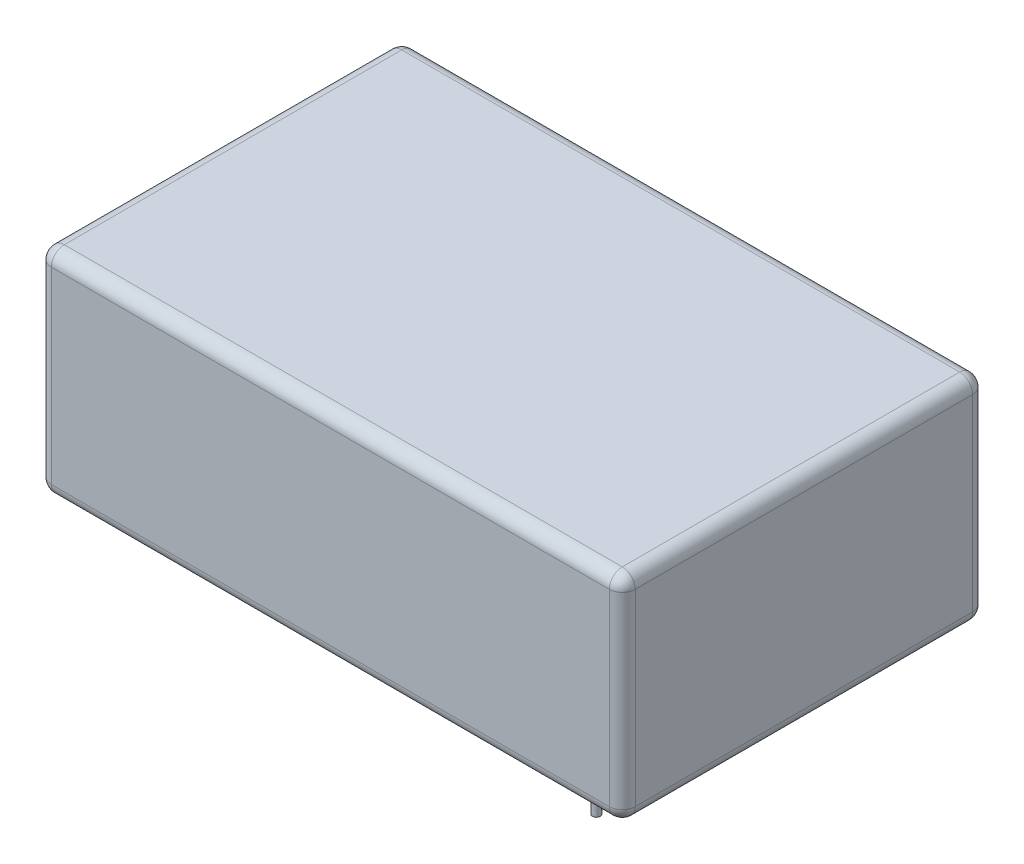
from build123d import *

# Parameters (mm, degrees)
SKETCH1_W           = 45
SKETCH1_H           = 16.5
BOSS_EXTRUDE1_DEPTH = 28
SKETCH2_R           = 0.3
BOSS_EXTRUDE2_DEPTH = 4
FILLET1_R           = 1


with BuildPart() as part:
    # Sketch1 → Boss-Extrude1 (new body)
    with BuildSketch(Plane.XY):
        with Locations((22.5, 8.25)):
            Rectangle(SKETCH1_W, SKETCH1_H)
    extrude(amount=BOSS_EXTRUDE1_DEPTH)

    # Sketch2 → Boss-Extrude2 (add)
    with BuildSketch(Plane(origin=(0, 0, 0), x_dir=(-1, 0, 0), z_dir=(0, -1, 0))):
        with Locations(Location((-6, -19, 0), (0, 0, 270))):
            Circle(SKETCH2_R)
        with Locations(Location((-6, -9, 0), (0, 0, 270))):
            Circle(SKETCH2_R)
        with Locations(Location((-39, -24, 0), (0, 0, 270))):
            Circle(SKETCH2_R)
        with Locations(Location((-39, -4, 0), (0, 0, 270))):
            Circle(SKETCH2_R)
    extrude(amount=BOSS_EXTRUDE2_DEPTH)

    # Fillet1
    fillet1_edges = [part.edges().sort_by_distance(p)[0] for p in [
        (45, 8.25, 28),
        (22.5, 16.5, 28),
        (6, 0, 18.7),
        (6, 0, 8.7),
        (39, 0, 23.7),
        (39, 0, 3.7),
        (0, 8.25, 28),
        (22.5, 16.5, 0),
        (45, 8.25, 0),
        (22.5, 0, 0),
        (0, 8.25, 0),
        (22.5, 0, 28),
        (0, 16.5, 14),
        (45, 16.5, 14),
        (45, 0, 14),
        (0, 0, 14),
    ]]
    fillet(fillet1_edges, radius=FILLET1_R)


solid = part.part
